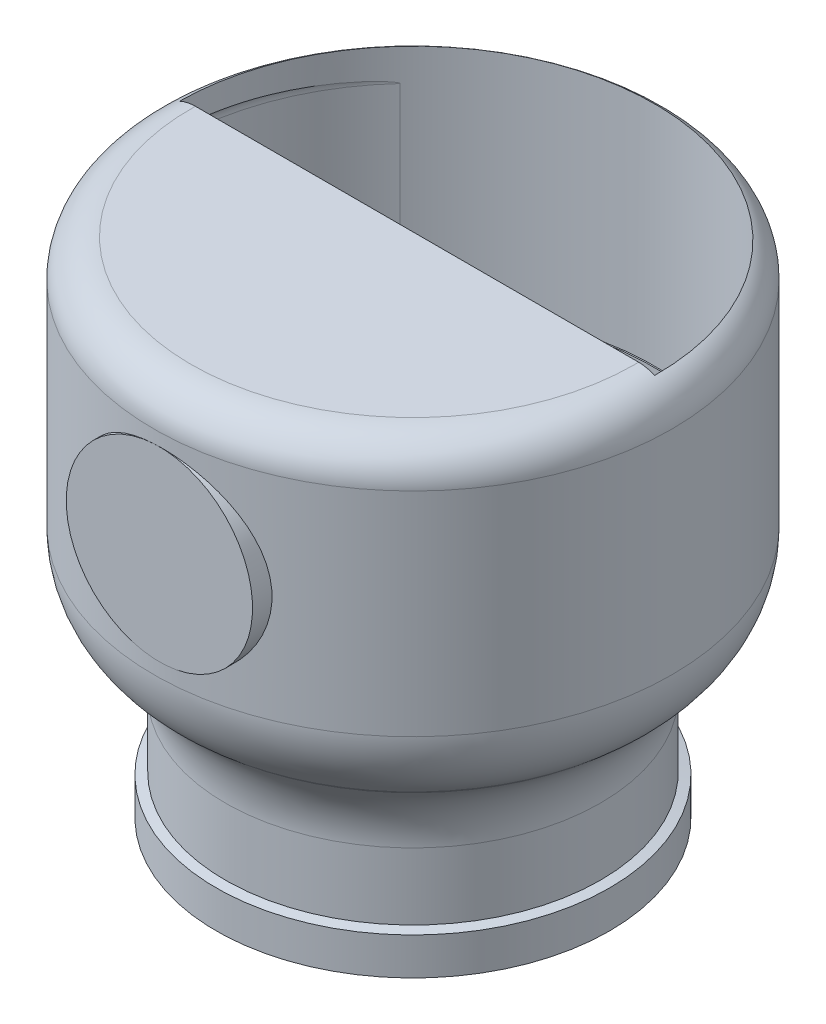
from build123d import *
from build123d.topology import SkipClean

# Parameters (mm, degrees)
CUT_EXTRUDE2_DEPTH  = 25
SKETCH10_R          = 10
BOSS_EXTRUDE1_DEPTH = 5


with BuildPart() as part:
    # Sketch1 → Revolve1 (revolve)
    with BuildSketch(Plane.XY):
        with BuildLine():
            Line((20.9, 0), (23.871591838, 0))
            Line((23.871591838, 0), (23.871591838, 4))
            Line((23.871591838, 4), (22.9, 4.236662843))
            Line((22.9, 4.236662843), (22.9, 11.404308102))
            ThreePointArc((22.9, 11.404308102), (23.83692213, 15.63049072), (26.472123903, 19.064752533))
            Line((26.472123903, 19.064752533), (26.988320528, 19.497892931))
            ThreePointArc((26.988320528, 19.497892931), (29.623522302, 22.932154745), (30.560444431, 27.158337362))
            Line((30.560444431, 27.158337362), (30.560444431, 50))
            ThreePointArc((30.560444431, 50), (29.388871556, 52.828427125), (26.560444431, 54))
            Line((26.560444431, 54), (2.764914955, 54))
            Line((2.764914955, 54), (2.764914955, 52))
            Line((2.764914955, 52), (26.560444431, 52))
            ThreePointArc((26.560444431, 52), (27.974657994, 51.414213562), (28.560444431, 50))
            Line((28.560444431, 50), (28.560444431, 28.090952678))
            ThreePointArc((28.560444431, 28.090952678), (27.623522302, 23.864770061), (24.988320528, 20.430508247))
            Line((24.988320528, 20.430508247), (23.688173754, 19.339555569))
            ThreePointArc((23.688173754, 19.339555569), (20.680499091, 17.603073792), (17.260297657, 17))
            Line((17.260297657, 17), (2.764914955, 17))
            Line((2.764914955, 17), (2.764914955, 15))
            Line((2.764914955, 15), (19.9, 15))
            ThreePointArc((19.9, 15), (20.607106781, 14.707106781), (20.9, 14))
            Line((20.9, 14), (20.9, 0))
        make_face()
    revolve(axis=Axis((2.764914955, 7.821821657, 0), (0, 1, 0)))

    # Sketch9 → Cut-Extrude2 (cut)
    with BuildSketch(Plane(origin=(0, 54, 0), x_dir=(1, 0, 0), z_dir=(0, 1, 0))):
        with BuildLine():
            Line((-22.735085045, 0.437631804), (28.264914955, 0.437631804))
            ThreePointArc((28.264914955, 0.437631804), (2.764914955, 25.937631804), (-22.735085045, 0.437631804))
        make_face()
    extrude(amount=-CUT_EXTRUDE2_DEPTH, mode=Mode.SUBTRACT)

    # Sketch10 → Boss-Extrude1 (add)
    with SkipClean():  # the faces are left unmerged after this step: merging them gives an invalid solid
        with BuildSketch(Plane.XY.offset(27.795529476)):
            with Locations((3.346345887, 38.658337362)):
                Circle(SKETCH10_R)
        extrude(amount=-BOSS_EXTRUDE1_DEPTH)


solid = part.part
